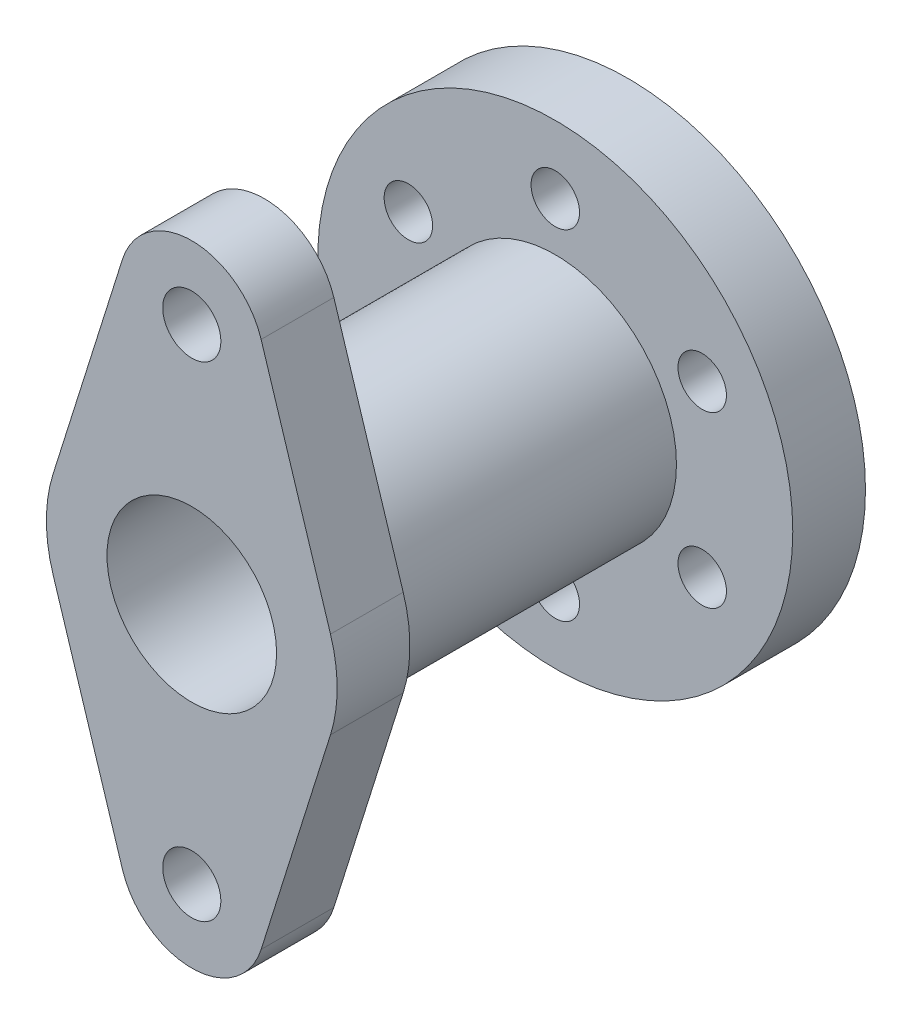
from build123d import *

# Parameters (mm, degrees)
SKETCH1_R           = 1244.6
BOSS_EXTRUDE1_DEPTH = 190.5
SKETCH2_R           = 127
CUT_EXTRUDE1_DEPTH  = 1801.894033529
SKETCH3_R           = 635
BOSS_EXTRUDE2_DEPTH = 1524
SKETCH5_R           = 152.4
BOSS_EXTRUDE3_DEPTH = 381
SKETCH6_R           = 444.5
BOSS_EXTRUDE4_DEPTH = 762
SKETCH7_R           = 444.5
CUT_EXTRUDE2_DEPTH  = 762
SKETCH8_R           = 330.2
CUT_EXTRUDE3_DEPTH  = 2569.541640698


with BuildPart() as part:
    # Sketch1 → Boss-Extrude1 (new, symmetric)
    with BuildSketch(Plane.XY):
        Circle(SKETCH1_R)
    extrude(amount=BOSS_EXTRUDE1_DEPTH, both=True)

    # Sketch2 → Cut-Extrude1 (cut, through all)
    with BuildSketch(Plane.XY.offset(190.5)):
        with Locations((0, 889)):
            Circle(SKETCH2_R)
        with Locations((769.896583964, 444.5)):
            Circle(SKETCH2_R)
        with Locations((769.896583964, -444.5)):
            Circle(SKETCH2_R)
        with Locations((0, -889)):
            Circle(SKETCH2_R)
        with Locations((-769.896583964, -444.5)):
            Circle(SKETCH2_R)
        with Locations((-769.896583964, 444.5)):
            Circle(SKETCH2_R)
    extrude(amount=-CUT_EXTRUDE1_DEPTH, mode=Mode.SUBTRACT)

    # Sketch3 → Boss-Extrude2 (add)
    with BuildSketch(Plane.XY.offset(190.5)):
        Circle(SKETCH3_R)
    extrude(amount=BOSS_EXTRUDE2_DEPTH)

    # Sketch5 → Boss-Extrude3 (add)
    with BuildSketch(Plane.XY.offset(1714.5)):
        with BuildLine():
            Line((-363.45083574, 1384.3), (-726.90167148, 228.6))
            ThreePointArc((-726.90167148, 228.6), (-762, 0), (-726.90167148, -228.6))
            Line((-726.90167148, -228.6), (-363.45083574, -1384.3))
            ThreePointArc((-363.45083574, -1384.3), (0, -1651), (363.45083574, -1384.3))
            Line((363.45083574, -1384.3), (726.90167148, -228.6))
            ThreePointArc((726.90167148, -228.6), (762, 0), (726.90167148, 228.6))
            Line((726.90167148, 228.6), (363.45083574, 1384.3))
            ThreePointArc((363.45083574, 1384.3), (0, 1651), (-363.45083574, 1384.3))
        make_face()
        with Locations((0, 1270)):
            Circle(SKETCH5_R, mode=Mode.SUBTRACT)
        with Locations((0, -1270)):
            Circle(SKETCH5_R, mode=Mode.SUBTRACT)
    extrude(amount=BOSS_EXTRUDE3_DEPTH)

    # Sketch6 → Boss-Extrude4 (add)
    with BuildSketch(Plane.XY.offset(2095.5)):
        Circle(SKETCH6_R)
    extrude(amount=-BOSS_EXTRUDE4_DEPTH)

    # Sketch7 → Cut-Extrude2 (cut)
    with BuildSketch(Plane.XY.offset(2095.5)):
        Circle(SKETCH7_R)
    extrude(amount=-CUT_EXTRUDE2_DEPTH, mode=Mode.SUBTRACT)

    # Sketch8 → Cut-Extrude3 (cut, through all)
    with BuildSketch(Plane.XY.offset(1333.5)):
        Circle(SKETCH8_R)
    extrude(amount=-CUT_EXTRUDE3_DEPTH, mode=Mode.SUBTRACT)


solid = part.part
